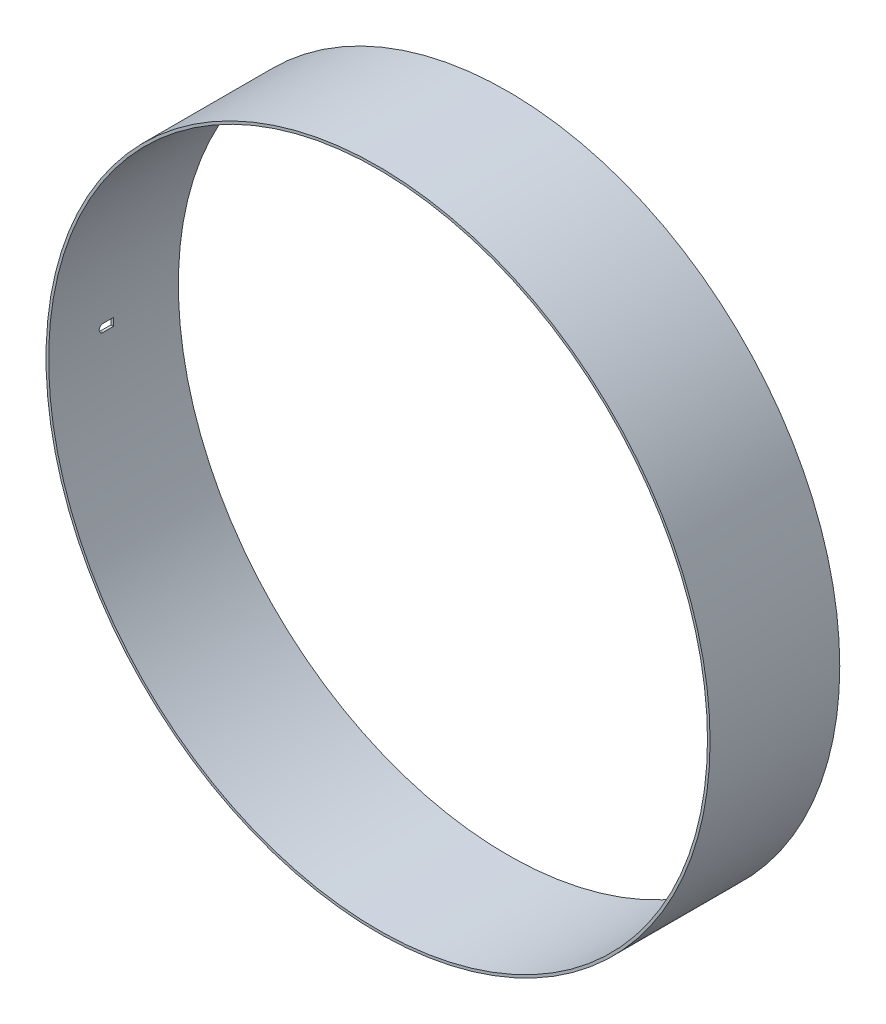
from build123d import *

# Parameters (mm, degrees)
SKETCH_1_R          = 64
SKETCH_1_R_2        = 63.5
EXTRUDE_1_DEPTH     = 25
CUT_EXTRUDE_1_DEPTH = 2000


with BuildPart() as part:
    # 草图1 → 凸台-拉伸1 (new body)
    with BuildSketch(Plane.XY):
        Circle(SKETCH_1_R)
        Circle(SKETCH_1_R_2, mode=Mode.SUBTRACT)
    extrude(amount=EXTRUDE_1_DEPTH)

    # 草图2 → 切除-拉伸1 (cut)
    with BuildSketch(Plane(origin=(0, 0, 0), x_dir=(0, 0, -1), z_dir=(1, 0, 0))):
        with BuildLine():
            Line((-14.5, -0.75), (-12.5, -0.75))
            Line((-12.5, -0.75), (-12.5, 0.75))
            Line((-12.5, 0.75), (-14.5, 0.75))
            ThreePointArc((-14.5, 0.75), (-15.25, 0), (-14.5, -0.75))
        make_face()
    extrude(amount=-CUT_EXTRUDE_1_DEPTH, mode=Mode.SUBTRACT)


solid = part.part
